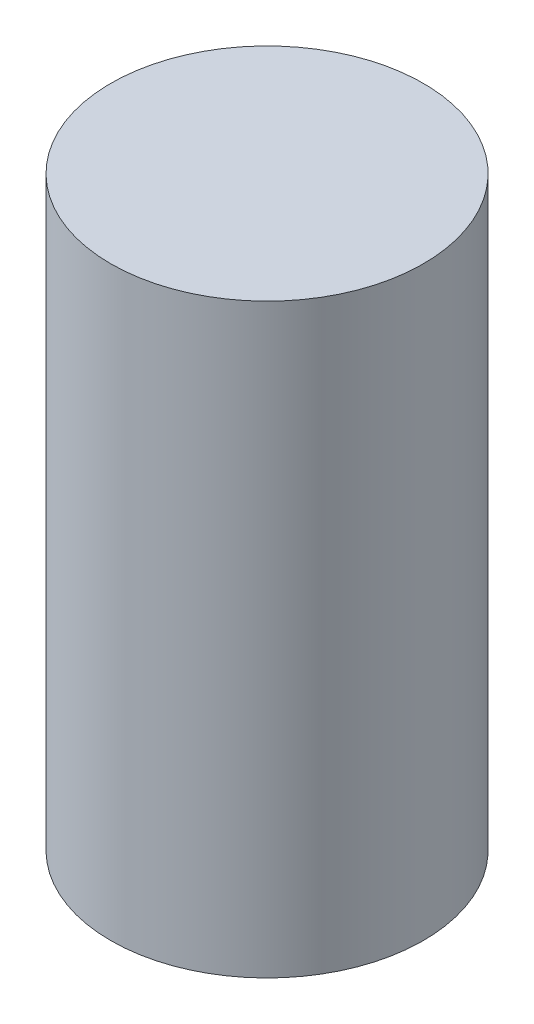
from build123d import *

# Parameters (mm, degrees)
SKETCH1_R           = 40
BOSS_EXTRUDE1_DEPTH = 150


with BuildPart() as part:
    # Sketch1 → Boss-Extrude1 (new body)
    with BuildSketch(Plane(origin=(0, 0, 0), x_dir=(1, 0, 0), z_dir=(0, 1, 0))):
        with Locations(Location((0, 0, 0), (0, 0, 270))):
            Circle(SKETCH1_R)
    extrude(amount=BOSS_EXTRUDE1_DEPTH)


solid = part.part
